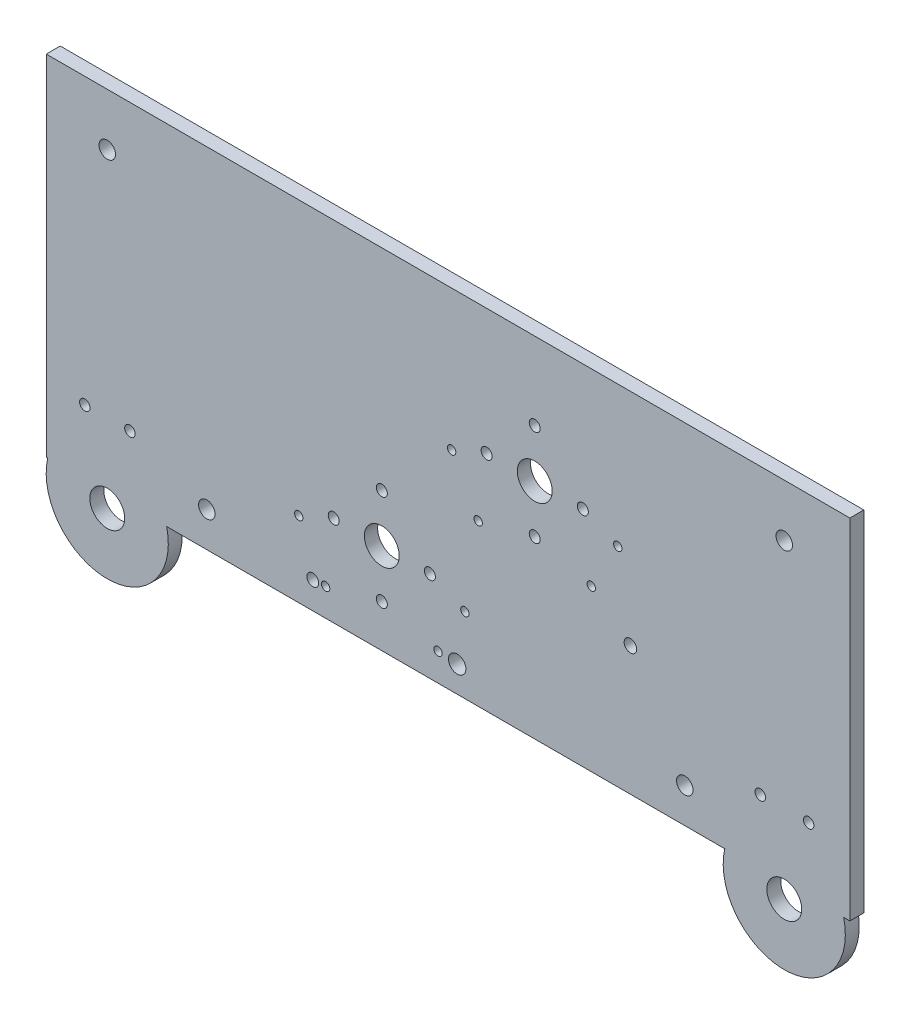
from build123d import *

# Parameters (mm, degrees)
BOSS_EXTRUDE1_DEPTH      = 5.07492
SKETCH6_R                = 22.225
BOSS_EXTRUDE3_DEPTH      = 5.07492
SKETCH2_3_R              = 6.35
CUT_EXTRUDE2_DEPTH       = 5.588
SKETCH8_W                = 2.728150378
SKETCH8_H                = 127
BOSS_EXTRUDE4_DEPTH      = 5.07492
SKETCH9_W                = 3.563296166
SKETCH9_H                = 127
BOSS_EXTRUDE5_DEPTH      = 5.07492
SKETCH12_R               = 3
CUT_EXTRUDE3_DEPTH       = 400.05
SKETCH13_3_R             = 2
CUT_EXTRUDE10_DEPTH      = 1549.4
SKETCH15_R               = 2.9972
CUT_EXTRUDE11_DEPTH      = 1549.4
SKETCH13_4_R             = 6.35
CUT_EXTRUDE12_DEPTH      = 1549.4
CUT_EXTRUDE13_START      = 223.266
SKETCH13_R               = 22.86
SKETCH13_R_2             = 2
SKETCH13_R_3             = 6.35
CUT_EXTRUDE13_DEPTH      = 1549.4
CUT_EXTRUDE14_DEPTH      = 2.54
CUT_EXTRUDE14_DEPTH_BACK = 6.35
SKETCH16_R               = 1.524
SKETCH17_R               = 1.905
CUT_EXTRUDE15_DEPTH      = 6.35
SKETCH18_R               = 2.159
SKETCH18_R_2             = 3.175
SKETCH18_R_3             = 2.286
CUT_EXTRUDE16_DEPTH      = 6.35


with BuildPart() as part:
    # Sketch2 → Boss-Extrude1 (new body)
    with BuildSketch(Plane.XY):
        with BuildLine():
            Line((-143.383, -31.75), (-127.127, -31.75))
            ThreePointArc((-127.127, -31.75), (-123.317, -30.48), (-119.507, -31.75))
            Line((-119.507, -31.75), (119.253, -31.75))
            ThreePointArc((119.253, -31.75), (123.063, -30.48), (126.873, -31.75))
            Line((126.873, -31.75), (143.383, -31.75))
            Line((143.383, -31.75), (143.383, 95.25))
            Line((143.383, 95.25), (-143.383, 95.25))
            Line((-143.383, 95.25), (-143.383, -31.75))
        make_face()
    extrude(amount=-BOSS_EXTRUDE1_DEPTH)

    # Sketch6 → Boss-Extrude3 (add)
    with BuildSketch(Plane(origin=(0, 0, -5.07492), x_dir=(-1, 0, 0), z_dir=(0, 0, -1))):
        with Locations((-123.063, -36.83)):
            Circle(SKETCH6_R)
        with Locations((123.317, -36.83)):
            Circle(SKETCH6_R)
    extrude(amount=-BOSS_EXTRUDE3_DEPTH)

    # Sketch2<3> → Cut-Extrude2 (cut)
    with BuildSketch(Plane.XY):
        with Locations((-123.317, -36.83)):
            Circle(SKETCH2_3_R)
        with Locations((123.063, -36.83)):
            Circle(SKETCH2_3_R)
    extrude(amount=-CUT_EXTRUDE2_DEPTH, mode=Mode.SUBTRACT)

    # Sketch8 → Boss-Extrude4 (add)
    with BuildSketch(Plane(origin=(0, 0, -5.07492), x_dir=(-1, 0, 0), z_dir=(0, 0, -1))):
        with Locations((144.139824811, 31.75)):
            Rectangle(SKETCH8_W, SKETCH8_H)
    extrude(amount=-BOSS_EXTRUDE4_DEPTH)

    # Sketch9 → Boss-Extrude5 (add)
    with BuildSketch(Plane(origin=(0, 0, -5.07492), x_dir=(-1, 0, 0), z_dir=(0, 0, -1))):
        with Locations((-145.164648083, 31.75)):
            Rectangle(SKETCH9_W, SKETCH9_H)
    extrude(amount=-BOSS_EXTRUDE5_DEPTH)

    # Sketch12 → Cut-Extrude3 (cut)
    with BuildSketch(Plane.XY):
        with Locations((-123.317, 76.2)):
            Circle(SKETCH12_R)
        with Locations((123.063, 76.2)):
            Circle(SKETCH12_R)
    extrude(amount=-CUT_EXTRUDE3_DEPTH, mode=Mode.SUBTRACT)


with BuildPart() as body_2:
    # Mirror1: mirrored copy
    add(part.part.mirror(Plane(origin=(0, 0, -114.29492), x_dir=(1, 0, 0), z_dir=(0, 0, -1))))

    # Sketch13<3> → Cut-Extrude10 (cut)
    with BuildSketch(Plane(origin=(0, 0, -5.07492), x_dir=(-1, 0, 0), z_dir=(0, 0, -1))):
        with Locations((-32.258, 67.0306)):
            Circle(SKETCH13_3_R)
        with Locations((-14.7574, 49.53)):
            Circle(SKETCH13_3_R)
        with Locations((-32.258, 32.0294)):
            Circle(SKETCH13_3_R)
        with Locations((-49.7586, 49.53)):
            Circle(SKETCH13_3_R)
        with Locations((23.390611843, 18.7706)):
            Circle(SKETCH13_3_R)
        with Locations((40.891211843, 1.27)):
            Circle(SKETCH13_3_R)
        with Locations((23.390611843, -16.2306)):
            Circle(SKETCH13_3_R)
        with Locations((5.890011843, 1.27)):
            Circle(SKETCH13_3_R)
    extrude(amount=CUT_EXTRUDE10_DEPTH, mode=Mode.SUBTRACT)

    # Sketch15 → Cut-Extrude11 (cut)
    with BuildSketch(Plane.XY.offset(-223.51492)):
        with Locations((-87.0839, -19.05)):
            Circle(SKETCH15_R)
        with Locations((86.868, -19.05)):
            Circle(SKETCH15_R)
    extrude(amount=-CUT_EXTRUDE11_DEPTH, mode=Mode.SUBTRACT)

    # Sketch13<4> → Cut-Extrude12 (cut)
    with BuildSketch(Plane(origin=(0, 0, -5.07492), x_dir=(-1, 0, 0), z_dir=(0, 0, -1))):
        with Locations((-32.258, 49.53)):
            Circle(SKETCH13_4_R)
        with Locations((23.390611843, 1.27)):
            Circle(SKETCH13_4_R)
    extrude(amount=CUT_EXTRUDE12_DEPTH, mode=Mode.SUBTRACT)

    # Sketch13 → Cut-Extrude13 (cut)
    # profile 1 of 2: a face of its own
    with BuildSketch(Plane(origin=(0, 0, -5.07492), x_dir=(-1, 0, 0), z_dir=(0, 0, -1)).offset(CUT_EXTRUDE13_START)):
        with Locations((23.390611843, 1.27)):
            Circle(SKETCH13_R)
        with Locations((23.390611843, 18.7706)):
            Circle(SKETCH13_R_2, mode=Mode.SUBTRACT)
        with Locations((40.891211843, 1.27)):
            Circle(SKETCH13_R_2, mode=Mode.SUBTRACT)
        with Locations((23.390611843, -16.2306)):
            Circle(SKETCH13_R_2, mode=Mode.SUBTRACT)
        with Locations((5.890011843, 1.27)):
            Circle(SKETCH13_R_2, mode=Mode.SUBTRACT)
        with Locations((23.390611843, 1.27)):
            Circle(SKETCH13_R_3, mode=Mode.SUBTRACT)
    # profile 2 of 2: a face of its own
    with BuildSketch(Plane(origin=(0, 0, -5.07492), x_dir=(-1, 0, 0), z_dir=(0, 0, -1)).offset(CUT_EXTRUDE13_START)):
        with Locations((-32.258, 49.53)):
            Circle(SKETCH13_R)
        with Locations((-32.258, 67.0306)):
            Circle(SKETCH13_R_2, mode=Mode.SUBTRACT)
        with Locations((-14.7574, 49.53)):
            Circle(SKETCH13_R_2, mode=Mode.SUBTRACT)
        with Locations((-32.258, 32.0294)):
            Circle(SKETCH13_R_2, mode=Mode.SUBTRACT)
        with Locations((-49.7586, 49.53)):
            Circle(SKETCH13_R_2, mode=Mode.SUBTRACT)
        with Locations((-32.258, 49.53)):
            Circle(SKETCH13_R_3, mode=Mode.SUBTRACT)
    extrude(amount=CUT_EXTRUDE13_DEPTH, mode=Mode.SUBTRACT)

    # Sketch16 → Cut-Extrude14 (cut, two sides: drawn at the far end of the back side and taken through both)
    with BuildSketch(Plane.XY.offset(-223.51492).offset(-CUT_EXTRUDE14_DEPTH_BACK)):
        with Locations((-53.618108667, -4.286724908)):
            Circle(SKETCH16_R)
        with Locations((6.836884982, -4.286724908)):
            Circle(SKETCH16_R)
        with Locations((-43.83565651, -21.677307131)):
            Circle(SKETCH16_R)
        with Locations((-2.945567175, -21.677307131)):
            Circle(SKETCH16_R)
        with Locations((2.007444266, 44.229302642)):
            Circle(SKETCH16_R)
        with Locations((62.486930452, 44.107336595)):
            Circle(SKETCH16_R)
        with Locations((11.683653899, 26.728907983)):
            Circle(SKETCH16_R)
        with Locations((52.832346101, 26.728907983)):
            Circle(SKETCH16_R)
    extrude(amount=CUT_EXTRUDE14_DEPTH + CUT_EXTRUDE14_DEPTH_BACK, mode=Mode.SUBTRACT)

    # Sketch17 → Cut-Extrude15 (cut)
    with BuildSketch(Plane.XY.offset(-223.51492)):
        with Locations((-131.474681475, -8.33115872)):
            Circle(SKETCH17_R)
        with Locations((-115.059944142, -8.33115872)):
            Circle(SKETCH17_R)
        with Locations((-123.317, -35.561808249)):
            Circle(SKETCH17_R)
        with Locations((123.063, -35.433)):
            Circle(SKETCH17_R)
        with Locations((114.346312611, -8.247692484)):
            Circle(SKETCH17_R)
        with Locations((131.954972652, -8.247692484)):
            Circle(SKETCH17_R)
    extrude(amount=-CUT_EXTRUDE15_DEPTH, mode=Mode.SUBTRACT)

    # Sketch18 → Cut-Extrude16 (cut)
    with BuildSketch(Plane.XY.offset(-223.51492)):
        with Locations((-48.522954976, -21.971)):
            Circle(SKETCH18_R)
        with Locations((4.033472896, -22.225)):
            Circle(SKETCH18_R_2)
        with Locations((67.080879188, 15.068285327)):
            Circle(SKETCH18_R_3)
    extrude(amount=-CUT_EXTRUDE16_DEPTH, mode=Mode.SUBTRACT)


solid = body_2.part
